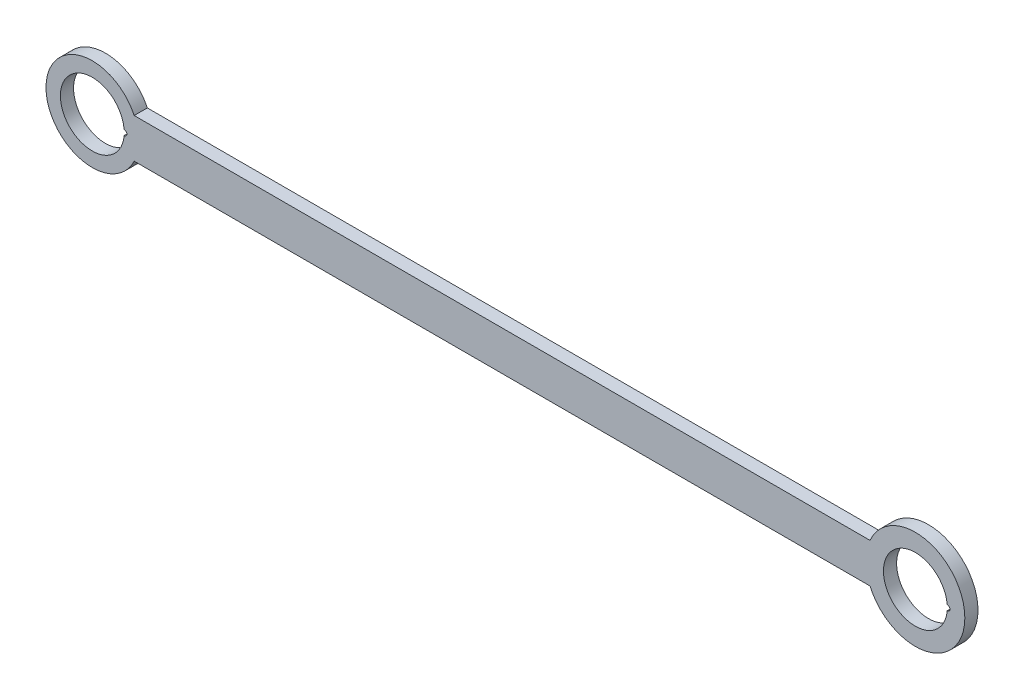
from build123d import *

# Parameters (mm, degrees)
SKETCH_1_R          = 9.7
EXTRUDE_1_DEPTH     = 4
SKETCH_3_R          = 0.8
CUT_EXTRUDE_1_DEPTH = 10


with BuildPart() as part:
    # 草图1 → 凸台-拉伸1 (new body)
    with BuildSketch(Plane.XY):
        with BuildLine():
            Line((12.718684308, 6), (236.224480753, 6))
            ThreePointArc((236.224480753, 6), (265.02547605, 0), (236.224480753, -6))
            Line((236.224480753, -6), (12.718684308, -6))
            ThreePointArc((12.718684308, -6), (-14.062891969, 0), (12.718684308, 6))
        make_face()
        Circle(SKETCH_1_R, mode=Mode.SUBTRACT)
        with Locations((250, 0)):
            Circle(SKETCH_1_R, mode=Mode.SUBTRACT)
    extrude(amount=EXTRUDE_1_DEPTH)

    # 草图3 → 切除-拉伸1 (cut)
    with BuildSketch(Plane.XY.offset(4)):
        with Locations((9.7, 0)):
            Circle(SKETCH_3_R)
        with Locations((259.7, 0)):
            Circle(SKETCH_3_R)
    extrude(amount=-CUT_EXTRUDE_1_DEPTH, mode=Mode.SUBTRACT)


solid = part.part
